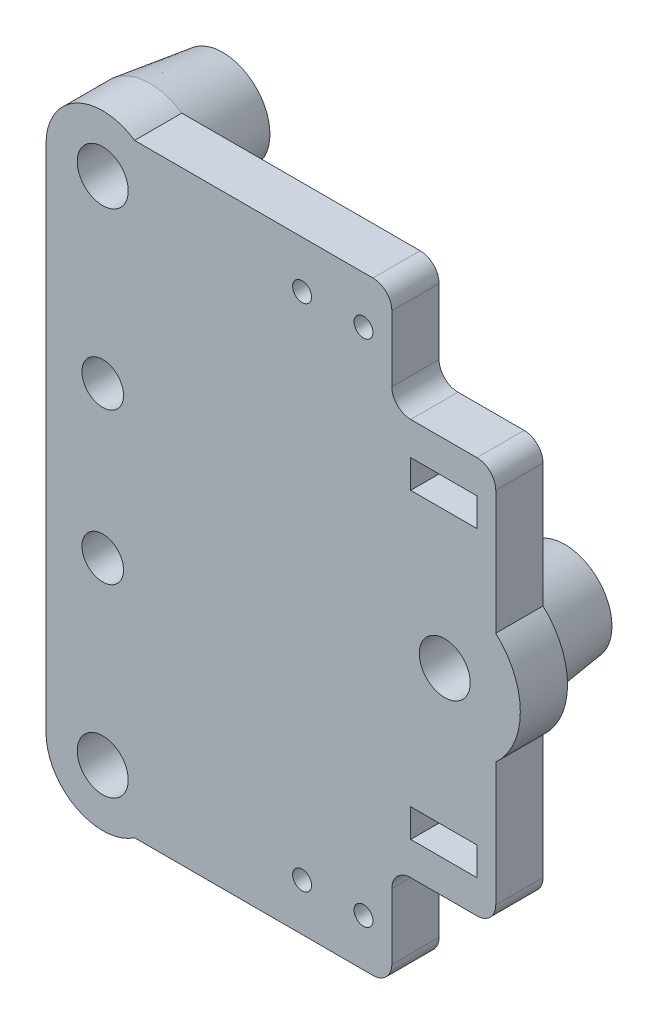
from build123d import *

# Parameters (mm, degrees)
SKETCH_1_R          = 2.2
SKETCH_1_R_2        = 2.7
EXTRUDE_1_DEPTH     = 5
CUT_EXTRUDE_1_REACH = 59.23
EXTRUDE_START       = -5
SKETCH_6_W          = 7
SKETCH_6_H          = 3
SKETCH_6_R          = 2.7
EXTRUDE_3_DEPTH     = 5
CUT_EXTRUDE_2_REACH = 45.949
SKETCH_8_R          = 1
FILLET_1_R          = 2


with BuildPart() as part:
    # 草图1 → 凸台-拉伸1 (new body)
    with BuildSketch(Plane.XY):
        with BuildLine():
            Line((-21.928513003, 31.619793089), (-45, 12.5))
            Line((-45, 12.5), (-45, -12.5))
            Line((-45, -12.5), (-21.928513003, -31.619793089))
            ThreePointArc((-21.928513003, -31.619793089), (-18.386291168, -32.993165888), (-14.729286549, -31.963697294))
            Line((-14.729286549, -31.963697294), (22.594284602, -6.618263059))
            ThreePointArc((22.594284602, -6.618263059), (26.1, 0), (22.594284602, 6.618263059))
            Line((22.594284602, 6.618263059), (-14.729286549, 31.963697294))
            ThreePointArc((-14.729286549, 31.963697294), (-18.386291168, 32.993165888), (-21.928513003, 31.619793089))
        make_face()
        with Locations((-18.1, -8)):
            Circle(SKETCH_1_R, mode=Mode.SUBTRACT)
        with Locations((-18.1, 8)):
            Circle(SKETCH_1_R, mode=Mode.SUBTRACT)
        with Locations((-34.1, 0)):
            Circle(SKETCH_1_R, mode=Mode.SUBTRACT)
        with Locations((-18.1, 27)):
            Circle(SKETCH_1_R_2, mode=Mode.SUBTRACT)
        with Locations((-18.1, -27)):
            Circle(SKETCH_1_R_2, mode=Mode.SUBTRACT)
        with Locations((18.1, 0)):
            Circle(SKETCH_1_R_2, mode=Mode.SUBTRACT)
    extrude(amount=EXTRUDE_1_DEPTH)

    # 草图4 → 旋转1 (revolve)
    with BuildSketch(Plane(origin=(-24.93598604, 16.933358057, 0), x_dir=(0, 0, -1), z_dir=(0.8272828823621655, -0.5617855752425007, 0)), mode=Mode.PRIVATE) as revolve_1_sk:
        Polygon((7.7, 17.168318912), (7.7, 14.868318912), (0, 14.868318912), (0, 18.168318912), align=None)
    revolve_1 = revolve(revolve_1_sk.sketch.rotate(Axis((-18.1, 27, 1000.278995542), (0, 0, -1)), 55.820627671), axis=Axis((-18.1, 27, 1000.278995542), (0, 0, -1)))

    # 镜向1: 旋转1 across plane
    add(revolve_1.mirror(Plane.ZX))

    # 草图5 → 切除-拉伸1 (cut, up to next)
    with BuildSketch(Plane.XY.offset(5), mode=Mode.PRIVATE) as cut_extrude_1_sk1:
        with BuildLine():
            Line((-24.1, -27), (-24.1, 27))
            ThreePointArc((-24.1, 27), (-23.53005884, 29.552344215), (-21.928513003, 31.619793089))
            Line((-21.928513003, 31.619793089), (-45, 12.5))
            Line((-45, 12.5), (-45, -12.5))
            Line((-45, -12.5), (-21.928513003, -31.619793089))
            ThreePointArc((-21.928513003, -31.619793089), (-23.53005884, -29.552344215), (-24.1, -27))
        make_face()
    cut_extrude_1_tool1 = extrude(cut_extrude_1_sk1.sketch, amount=-CUT_EXTRUDE_1_REACH, mode=Mode.PRIVATE) & part.part
    add(cut_extrude_1_tool1.solids().sort_by_distance((-33.100815, 0, 5))[0], mode=Mode.SUBTRACT)

    # 草图6 → 凸台-拉伸3 (add)
    with BuildSketch(Plane.XY.offset(5).offset(EXTRUDE_START)):
        Polygon((12.5, -13.473020485), (-14.729286549, -31.963697294), (12.5, -31.963697294), (12.5, -21), (23.5, -21), (23.5, 21), (12.5, 21), (12.5, 31.963697294), (-14.729286549, 31.963697294), (12.5, 13.473020485), align=None)
        with Locations((18, -16)):
            Rectangle(SKETCH_6_W, SKETCH_6_H, mode=Mode.SUBTRACT)
        with Locations((18.1, 0)):
            Circle(SKETCH_6_R, mode=Mode.SUBTRACT)
        with Locations((18, 16)):
            Rectangle(SKETCH_6_W, SKETCH_6_H, mode=Mode.SUBTRACT)
    extrude(amount=EXTRUDE_3_DEPTH)

    # 草图8 → 切除-拉伸2 (cut, up to next)
    with BuildSketch(Plane.XY.offset(5), mode=Mode.PRIVATE) as cut_extrude_2_sk1:
        with Locations((9.5, -26.963697294)):
            Circle(SKETCH_8_R)
    cut_extrude_2_tool1 = extrude(cut_extrude_2_sk1.sketch, amount=-CUT_EXTRUDE_2_REACH, mode=Mode.PRIVATE) & part.part
    # 草图8 → 切除-拉伸2 (cut, up to next)
    with BuildSketch(Plane.XY.offset(5), mode=Mode.PRIVATE) as cut_extrude_2_sk2:
        with Locations((3, -26.963697294)):
            Circle(SKETCH_8_R)
    cut_extrude_2_tool2 = extrude(cut_extrude_2_sk2.sketch, amount=-CUT_EXTRUDE_2_REACH, mode=Mode.PRIVATE) & part.part
    # 草图8 → 切除-拉伸2 (cut, up to next)
    with BuildSketch(Plane.XY.offset(5), mode=Mode.PRIVATE) as cut_extrude_2_sk3:
        with Locations((9.5, 26.963697294)):
            Circle(SKETCH_8_R)
    cut_extrude_2_tool3 = extrude(cut_extrude_2_sk3.sketch, amount=-CUT_EXTRUDE_2_REACH, mode=Mode.PRIVATE) & part.part
    # 草图8 → 切除-拉伸2 (cut, up to next)
    with BuildSketch(Plane.XY.offset(5), mode=Mode.PRIVATE) as cut_extrude_2_sk4:
        with Locations((3, 26.963697294)):
            Circle(SKETCH_8_R)
    cut_extrude_2_tool4 = extrude(cut_extrude_2_sk4.sketch, amount=-CUT_EXTRUDE_2_REACH, mode=Mode.PRIVATE) & part.part
    add(cut_extrude_2_tool1.solids().sort_by_distance((9.5, -26.963697, 5))[0], mode=Mode.SUBTRACT)
    add(cut_extrude_2_tool2.solids().sort_by_distance((3, -26.963697, 5))[0], mode=Mode.SUBTRACT)
    add(cut_extrude_2_tool3.solids().sort_by_distance((9.5, 26.963697, 5))[0], mode=Mode.SUBTRACT)
    add(cut_extrude_2_tool4.solids().sort_by_distance((3, 26.963697, 5))[0], mode=Mode.SUBTRACT)

    # 草图7 → 旋转2 (revolve)
    with BuildSketch(Plane(origin=(6.469864276, 8.674410623, 0), x_dir=(0.8015915013283047, -0.5978721142503927, 0), z_dir=(0.5978721142503927, 0.8015915013283047, 0)), mode=Mode.PRIVATE) as revolve_2_sk:
        Polygon((11.808806174, 7.7), (11.808806174, 0), (8.508806174, 0), (9.508806174, 7.7), align=None)
    revolve(revolve_2_sk.sketch.rotate(Axis((18.1, 0, 1), (0, 0, -1)), 143.282349417), axis=Axis((18.1, 0, 1), (0, 0, -1)))

    # 圆角1
    fillet_1_edges = [part.edges().sort_by_distance(p)[0] for p in [
        (12.5, 31.963697294, 2.5),
        (12.5, 21, 2.5),
        (23.5, 21, 2.5),
        (12.5, -21, 2.5),
        (23.5, -21, 2.5),
        (12.5, -31.963697294, 2.5),
    ]]
    fillet(fillet_1_edges, radius=FILLET_1_R)


solid = part.part
